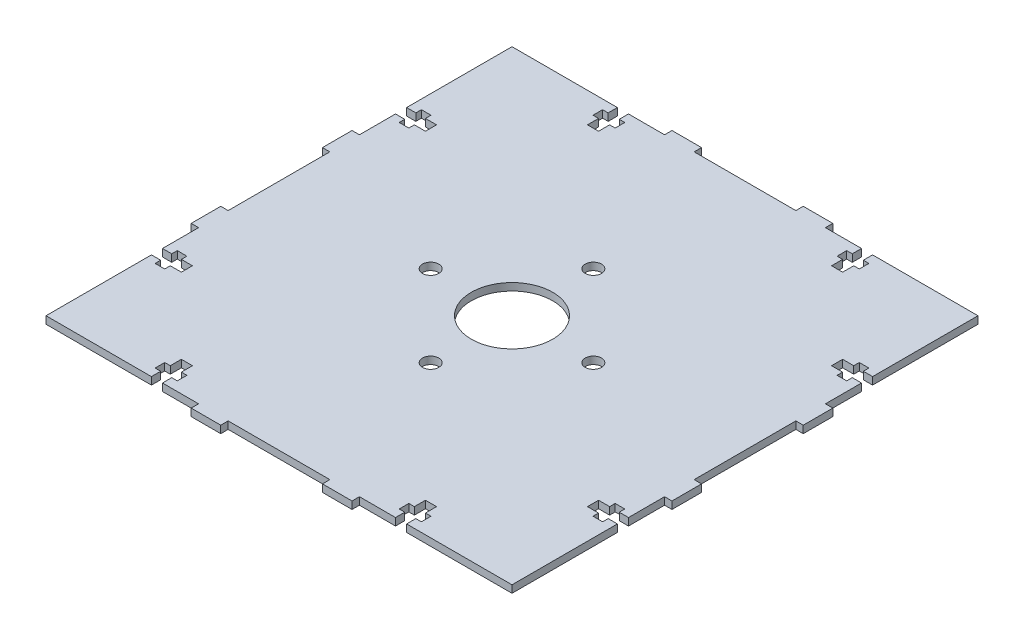
from build123d import *

# Parameters (mm, degrees)
SKETCH_1_R      = 11
SKETCH_1_R_2    = 2.2
EXTRUDE_1_DEPTH = 2


with BuildPart() as part:
    # 草图1 → 凸台-拉伸1 (new body)
    with BuildSketch(Plane(origin=(0, 0, 0), x_dir=(1, 0, 0), z_dir=(0, 1, 0))):
        Polygon((159.754738648, 48.995603023), (150.004738648, 48.995603023), (150.004738648, 46.495603023), (151.504738648, 46.495603023), (151.504738648, 43.895603023), (150.004738648, 43.895603023), (150.004738648, 40.895603023), (147.004738648, 40.895603023), (147.004738648, 43.895603023), (145.504738648, 43.895603023), (145.504738648, 46.495603023), (147.004738648, 46.495603023), (147.004738648, 48.995603023), (138.604738648, 48.995603023), (133.504738648, 48.995603023), (118.504738648, 48.995603023), (118.504738648, 33.995603023), (118.504738648, 21.495603023), (118.504738648, 20.495603023), (121.004738648, 20.495603023), (121.004738648, 21.995603023), (123.604738648, 21.995603023), (123.604738648, 20.495603023), (126.604738648, 20.495603023), (126.604738648, 17.495603023), (123.604738648, 17.495603023), (123.604738648, 15.995603023), (121.004738648, 15.995603023), (121.004738648, 17.495603023), (118.504738648, 17.495603023), (118.504738648, 7.745603023), (116.504738648, 7.745603023), (116.504738648, -0.254396977), (118.504738648, -0.254396977), (118.504738648, -27.754396977), (116.504738648, -27.754396977), (116.504738648, -35.754396977), (118.504738648, -35.754396977), (118.504738648, -45.504396977), (121.004738648, -45.504396977), (121.004738648, -44.004396977), (123.604738648, -44.004396977), (123.604738648, -45.504396977), (126.604738648, -45.504396977), (126.604738648, -48.504396977), (123.604738648, -48.504396977), (123.604738648, -50.004396977), (121.004738648, -50.004396977), (121.004738648, -48.504396977), (118.504738648, -48.504396977), (118.504738648, -56.904396977), (118.504738648, -62.004396977), (118.504738648, -77.004396977), (133.504738648, -77.004396977), (146.004738648, -77.004396977), (147.004738648, -77.004396977), (147.004738648, -74.504396977), (145.504738648, -74.504396977), (145.504738648, -71.904396977), (147.004738648, -71.904396977), (147.004738648, -68.904396977), (150.004738648, -68.904396977), (150.004738648, -71.904396977), (151.504738648, -71.904396977), (151.504738648, -74.504396977), (150.004738648, -74.504396977), (150.004738648, -77.004396977), (159.754738648, -77.004396977), (159.754738648, -79.004396977), (167.754738648, -79.004396977), (167.754738648, -77.004396977), (195.254738648, -77.004396977), (195.254738648, -79.004396977), (203.254738648, -79.004396977), (203.254738648, -77.004396977), (213.004738648, -77.004396977), (213.004738648, -74.504396977), (211.504738648, -74.504396977), (211.504738648, -71.904396977), (213.004738648, -71.904396977), (213.004738648, -68.904396977), (216.004738648, -68.904396977), (216.004738648, -71.904396977), (217.504738648, -71.904396977), (217.504738648, -74.504396977), (216.004738648, -74.504396977), (216.004738648, -77.004396977), (224.404738648, -77.004396977), (229.504738648, -77.004396977), (244.504738648, -77.004396977), (244.504738648, -62.004396977), (244.504738648, -49.504396977), (244.504738648, -48.504396977), (242.004738648, -48.504396977), (242.004738648, -50.004396977), (239.404738648, -50.004396977), (239.404738648, -48.504396977), (236.404738648, -48.504396977), (236.404738648, -45.504396977), (239.404738648, -45.504396977), (239.404738648, -44.004396977), (242.004738648, -44.004396977), (242.004738648, -45.504396977), (244.504738648, -45.504396977), (244.504738648, -35.754396977), (246.504738648, -35.754396977), (246.504738648, -27.754396977), (244.504738648, -27.754396977), (244.504738648, -0.254396977), (246.504738648, -0.254396977), (246.504738648, 7.745603023), (244.504738648, 7.745603023), (244.504738648, 17.495603023), (242.004738648, 17.495603023), (242.004738648, 15.995603023), (239.404738648, 15.995603023), (239.404738648, 17.495603023), (236.404738648, 17.495603023), (236.404738648, 20.495603023), (239.404738648, 20.495603023), (239.404738648, 21.995603023), (242.004738648, 21.995603023), (242.004738648, 20.495603023), (244.504738648, 20.495603023), (244.504738648, 28.895603023), (244.504738648, 33.995603023), (244.504738648, 48.995603023), (229.504738648, 48.995603023), (217.004738648, 48.995603023), (216.004738648, 48.995603023), (216.004738648, 46.495603023), (217.504738648, 46.495603023), (217.504738648, 43.895603023), (216.004738648, 43.895603023), (216.004738648, 40.895603023), (213.004738648, 40.895603023), (213.004738648, 43.895603023), (211.504738648, 43.895603023), (211.504738648, 46.495603023), (213.004738648, 46.495603023), (213.004738648, 48.995603023), (203.254738648, 48.995603023), (203.254738648, 50.995603023), (195.254738648, 50.995603023), (195.254738648, 48.995603023), (167.754738648, 48.995603023), (167.754738648, 50.995603023), (159.754738648, 50.995603023), align=None)
        with Locations(Location((181.504738648, -14.004396977, 0), (0, 0, 270))):
            Circle(SKETCH_1_R, mode=Mode.SUBTRACT)
        with Locations(Location((181.504738648, -36.004396977, 0), (0, 0, 270))):
            Circle(SKETCH_1_R_2, mode=Mode.SUBTRACT)
        with Locations(Location((159.504738648, -14.004396977, 0), (0, 0, 270))):
            Circle(SKETCH_1_R_2, mode=Mode.SUBTRACT)
        with Locations(Location((181.504738648, 7.995603023, 0), (0, 0, 270))):
            Circle(SKETCH_1_R_2, mode=Mode.SUBTRACT)
        with Locations(Location((203.504738648, -14.004396977, 0), (0, 0, 270))):
            Circle(SKETCH_1_R_2, mode=Mode.SUBTRACT)
    extrude(amount=EXTRUDE_1_DEPTH)


solid = part.part
